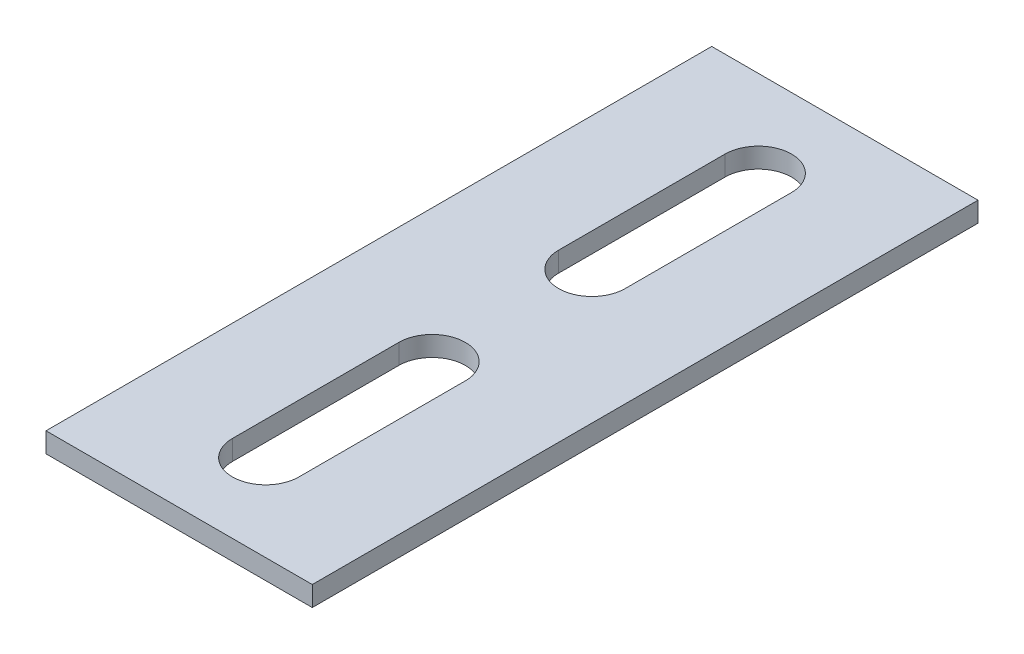
from build123d import *

# Parameters (mm, degrees)
SKETCH_2_W      = 40
SKETCH_2_H      = 100
EXTRUDE_1_DEPTH = 1.5


with BuildPart() as part:
    # Эскиз2 → Бобышка-Вытянуть1 (new, symmetric)
    with BuildSketch(Plane(origin=(0, 0, 0), x_dir=(1, 0, 0), z_dir=(0, 1, 0))):
        Rectangle(SKETCH_2_W, SKETCH_2_H)
        with BuildLine():
            Line((-5, 12), (-5, 37))
            ThreePointArc((-5, 37), (0, 42), (5, 37))
            Line((5, 37), (5, 12))
            ThreePointArc((5, 12), (0, 7), (-5, 12))
        make_face(mode=Mode.SUBTRACT)
        with BuildLine():
            Line((-5, -37), (-5, -12))
            ThreePointArc((-5, -12), (0, -7), (5, -12))
            Line((5, -12), (5, -37))
            ThreePointArc((5, -37), (0, -42), (-5, -37))
        make_face(mode=Mode.SUBTRACT)
    extrude(amount=EXTRUDE_1_DEPTH, both=True)


solid = part.part
